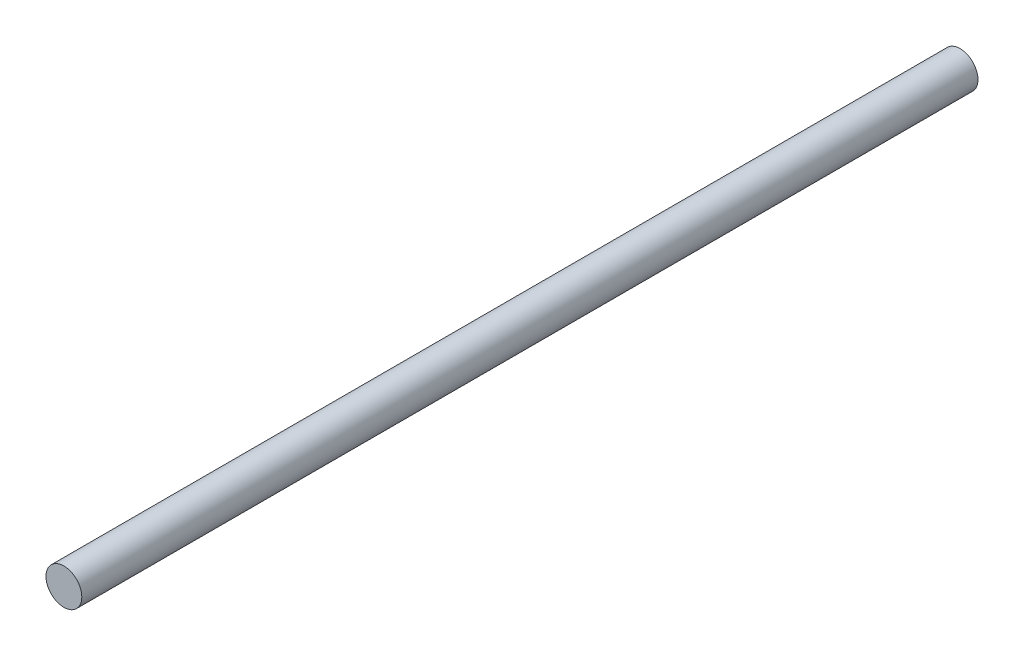
from build123d import *

# Parameters (mm, degrees)
ESBO_O1_R                = 4
RESSALTO_EXTRUS_O1_DEPTH = 200


with BuildPart() as part:
    # Esboço1 → Ressalto-extrusão1 (new body)
    with BuildSketch(Plane.XY):
        Circle(ESBO_O1_R)
    extrude(amount=RESSALTO_EXTRUS_O1_DEPTH)


solid = part.part
